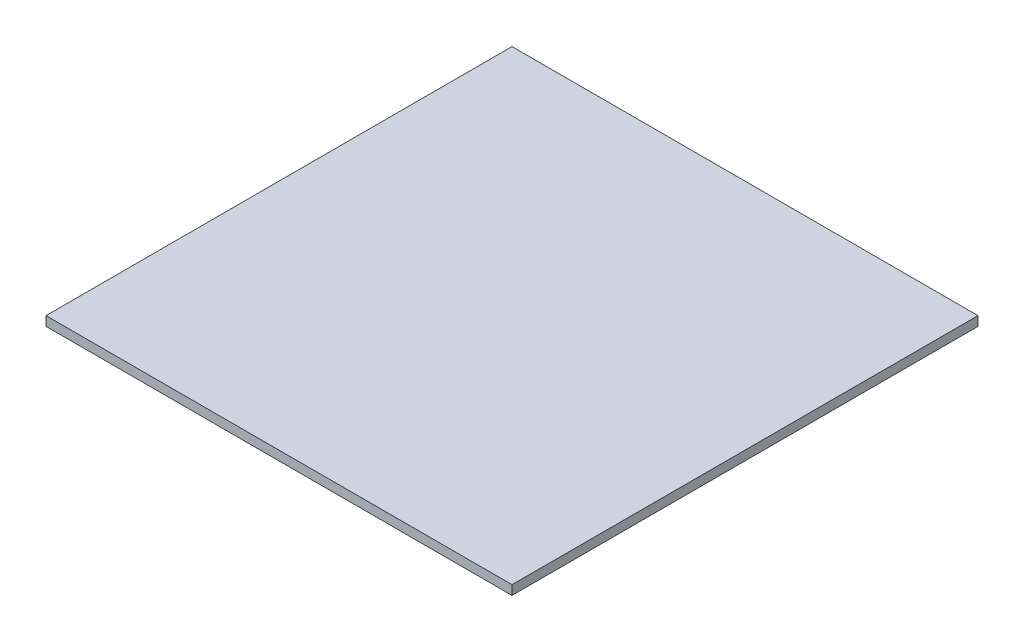
from build123d import *

# Parameters (mm, degrees)
SKICA1_W                = 127
SKICA1_H                = 127
P_IDAT_VYSUNUT_M1_DEPTH = 2.54


with BuildPart() as part:
    # Skica1 → Přidat vysunutím1 (new body)
    with BuildSketch(Plane(origin=(0, 0, 0), x_dir=(1, 0, 0), z_dir=(0, 1, 0))):
        with Locations((63.5, 63.5)):
            Rectangle(SKICA1_W, SKICA1_H)
    extrude(amount=P_IDAT_VYSUNUT_M1_DEPTH)


solid = part.part
